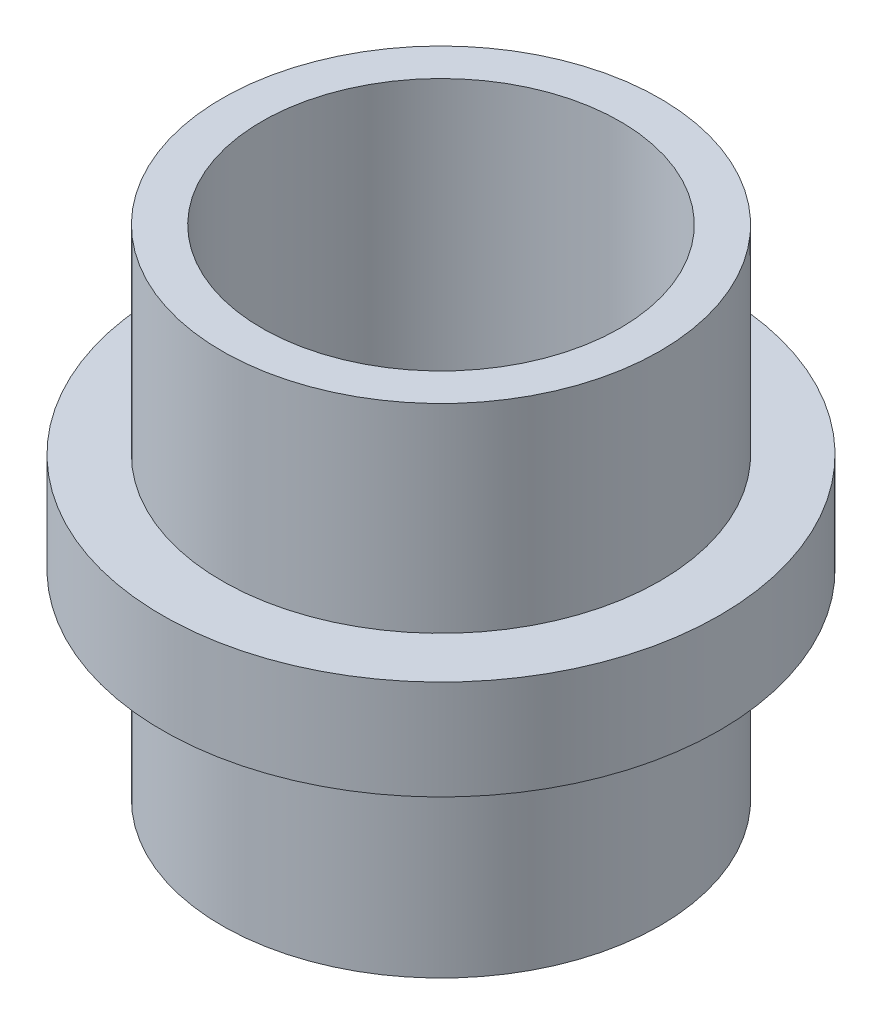
from build123d import *


with BuildPart() as part:
    # Sketch1 → Revolve1 (revolve)
    with BuildSketch(Plane.XY):
        Polygon((9, 12.5), (11, 12.5), (11, 2.5), (14, 2.5), (14, -2.5), (11, -2.5), (11, -12.5), (9, -12.5), align=None)
    revolve(axis=Axis((0, -12.5, 0), (0, 1, 0)))


solid = part.part
